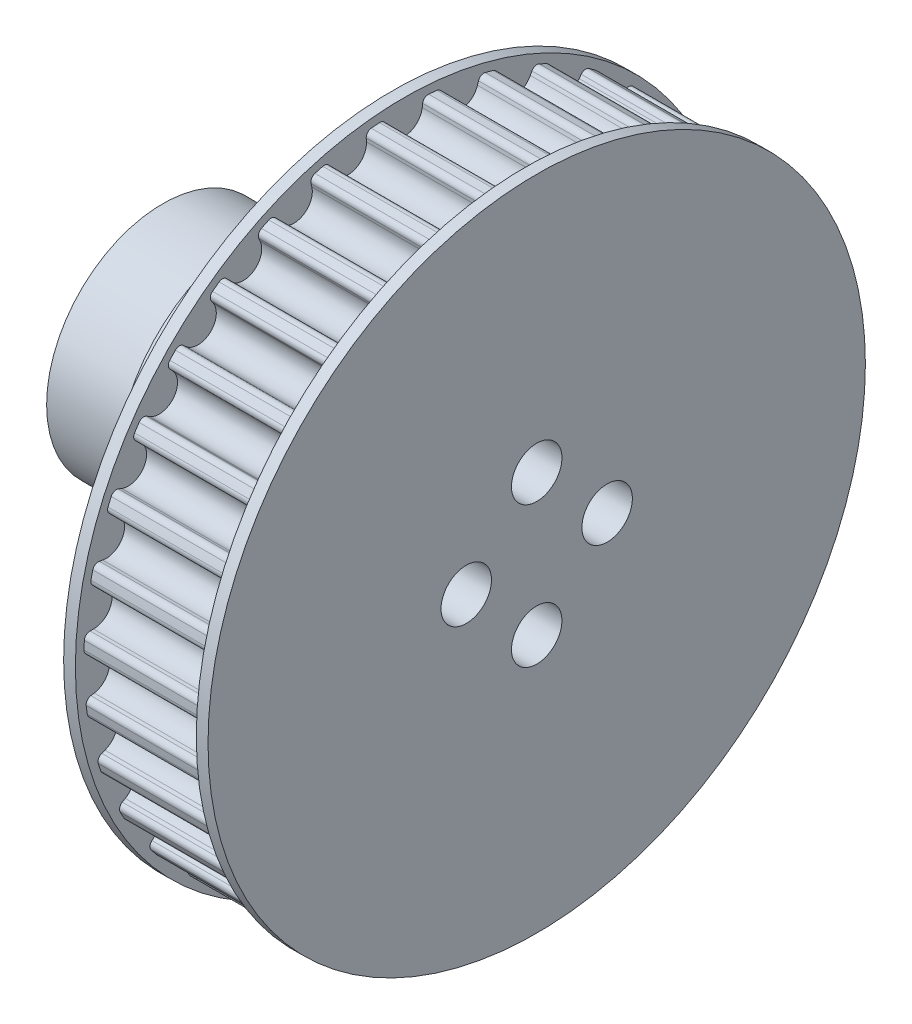
from build123d import *

# Parameters (mm, degrees)
SKETCH_1_W               = 10.3
SKETCH_1_H               = 27.278
CUT_EXTRUDE_2_REACH      = 41.928
PATTERN_CIRCULAR_3_COUNT = 35
SKETCH_7_R               = 28
EXTRUDE_1_DEPTH          = 1
EXTRUDE_START            = 1
SKETCH_8_R               = 28
EXTRUDE_2_DEPTH          = 1
SKETCH_9_R               = 12
EXTRUDE_3_DEPTH          = 11.55
SKETCH_10_R              = 9.9
EXTRUDE_4_DEPTH          = 8
SKETCH_11_R              = 2.15
CUT_EXTRUDE_3_DEPTH      = 51.817541263


with BuildPart() as part:
    # 草图1 → 旋转1 (revolve)
    with BuildSketch(Plane.XY):
        with Locations((5.15, 13.639)):
            Rectangle(SKETCH_1_W, SKETCH_1_H)
    revolve(axis=Axis((0, 0, 0), (1, 0, 0)))

    # 草图6 → 切除-拉伸2 (cut, up to next)
    with BuildSketch(Plane(origin=(0, 0, 0), x_dir=(0, 0, -1), z_dir=(1, 0, 0)), mode=Mode.PRIVATE) as cut_extrude_2_sk1:
        with BuildLine():
            Line((1.583892871, 26.777178128), (1.548371997, 26.487883824))
            ThreePointArc((1.548371997, 26.487883824), (0, 25.118), (-1.548371997, 26.487883824))
            Line((-1.548371997, 26.487883824), (-1.583892871, 26.777178128))
            ThreePointArc((-1.583892871, 26.777178128), (-1.756322779, 27.090149167), (-2.097218942, 27.197260096))
            ThreePointArc((-2.097218942, 27.197260096), (-2.346390889, 27.17689706), (-2.595365746, 27.154251244))
            Line((-2.595365746, 27.154251244), (-2.792013735, 28.755820587))
            ThreePointArc((-2.792013735, 28.755820587), (0, 28.891046335), (2.792013735, 28.755820587))
            Line((2.792013735, 28.755820587), (2.595365746, 27.154251244))
            ThreePointArc((2.595365746, 27.154251244), (2.346390889, 27.17689706), (2.097218942, 27.197260096))
            ThreePointArc((2.097218942, 27.197260096), (1.756322779, 27.090149167), (1.583892871, 26.777178128))
        make_face()
    cut_extrude_2_tool1 = extrude(cut_extrude_2_sk1.sketch, amount=CUT_EXTRUDE_2_REACH, mode=Mode.PRIVATE) & part.part
    cut_extrude_2 = cut_extrude_2_tool1.solids().sort_by_distance((0, 27.368813, 0))[0]
    add(cut_extrude_2, mode=Mode.SUBTRACT)

    # 阵列(圆周)3: 切除-拉伸2 ×35 about axis
    pattern_circular_3_axis = Axis((-1.4, 0, 0), (1, 0, 0))
    for i in range(1, PATTERN_CIRCULAR_3_COUNT):
        add(cut_extrude_2.rotate(pattern_circular_3_axis, i * 360 / PATTERN_CIRCULAR_3_COUNT), mode=Mode.SUBTRACT)

    # 草图7 → 凸台-拉伸1 (add)
    with BuildSketch(Plane(origin=(10.3, 0, 0), x_dir=(0, 0, -1), z_dir=(1, 0, 0))):
        Circle(SKETCH_7_R)
    extrude(amount=EXTRUDE_1_DEPTH)

    # 草图8 → 凸台-拉伸2 (add)
    with BuildSketch(Plane.ZY.offset(EXTRUDE_START)):
        Circle(SKETCH_8_R)
    extrude(amount=-EXTRUDE_2_DEPTH)

    # 草图9 → 凸台-拉伸3 (add)
    with BuildSketch(Plane.ZY.offset(1)):
        Circle(SKETCH_9_R)
    extrude(amount=EXTRUDE_3_DEPTH)

    # 草图10 → 凸台-拉伸4 (add)
    with BuildSketch(Plane.ZY.offset(12.55)):
        Circle(SKETCH_10_R)
    extrude(amount=EXTRUDE_4_DEPTH)

    # 草图11 → 切除-拉伸3 (cut, through all)
    with BuildSketch(Plane.ZY.offset(20.55)):
        with Locations((0, 6)):
            Circle(SKETCH_11_R)
        with Locations((6, 0)):
            Circle(SKETCH_11_R)
        with Locations((0, -6)):
            Circle(SKETCH_11_R)
        with Locations((-6, 0)):
            Circle(SKETCH_11_R)
    extrude(amount=-CUT_EXTRUDE_3_DEPTH, mode=Mode.SUBTRACT)


solid = part.part
